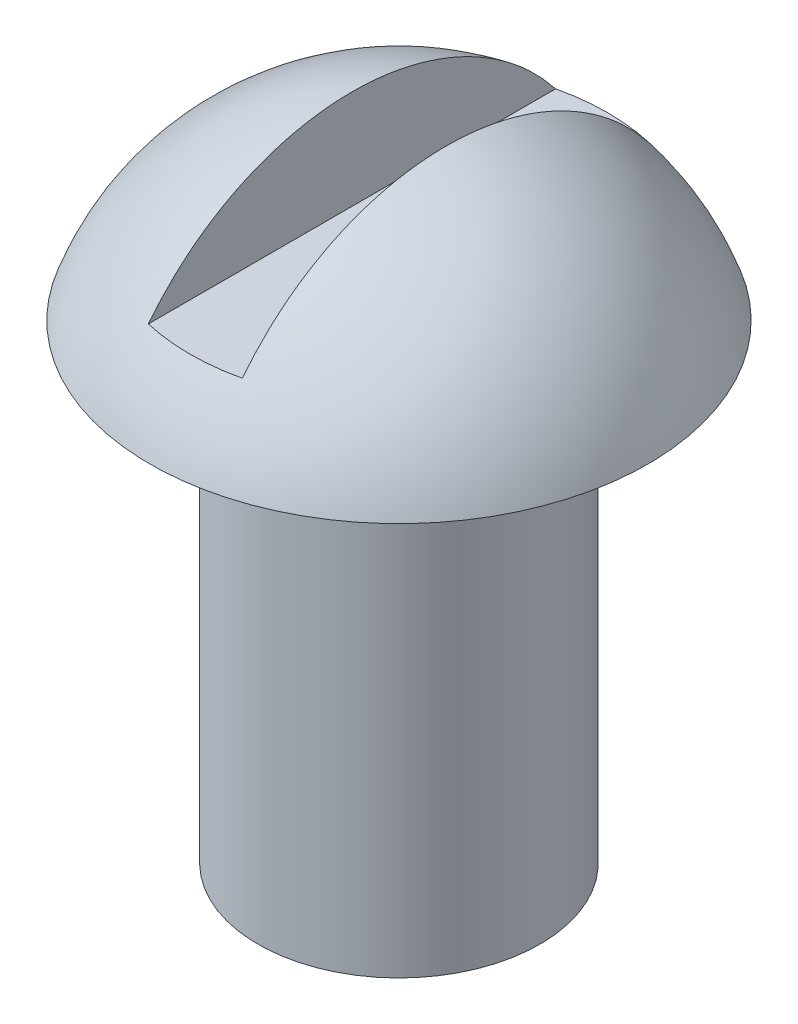
from build123d import *

# Parameters (mm, degrees)
SKETCH_2_W          = 1
SKETCH_2_H          = 5.907580982
CUT_EXTRUDE_1_DEPTH = 1.2
SKETCH_3_R          = 1.5
EXTRUDE_2_DEPTH     = 5


with BuildPart() as part:
    # Эскиз1 → Повернуть1 (revolve)
    with BuildSketch(Plane.XY):
        with BuildLine():
            Line((0, 0), (2.65, 0))
            ThreePointArc((2.65, 0), (1.630375724, 1.375918772), (0, 1.9))
            Line((0, 1.9), (0, 0))
        make_face()
    revolve(axis=Axis((0, 0, 0), (0, 1, 0)))

    # Эскиз2 → Вытянуть1 (cut)
    with BuildSketch(Plane(origin=(0, 2, 0), x_dir=(1, 0, 0), z_dir=(0, 1, 0))):
        Rectangle(SKETCH_2_W, SKETCH_2_H)
    extrude(amount=-CUT_EXTRUDE_1_DEPTH, mode=Mode.SUBTRACT)

    # Эскиз3 → Вытянуть2 (add)
    with BuildSketch(Plane.XZ):
        with Locations(Location((0, 0, 0), (0, 0, 270))):
            Circle(SKETCH_3_R)
    extrude(amount=EXTRUDE_2_DEPTH)


solid = part.part
